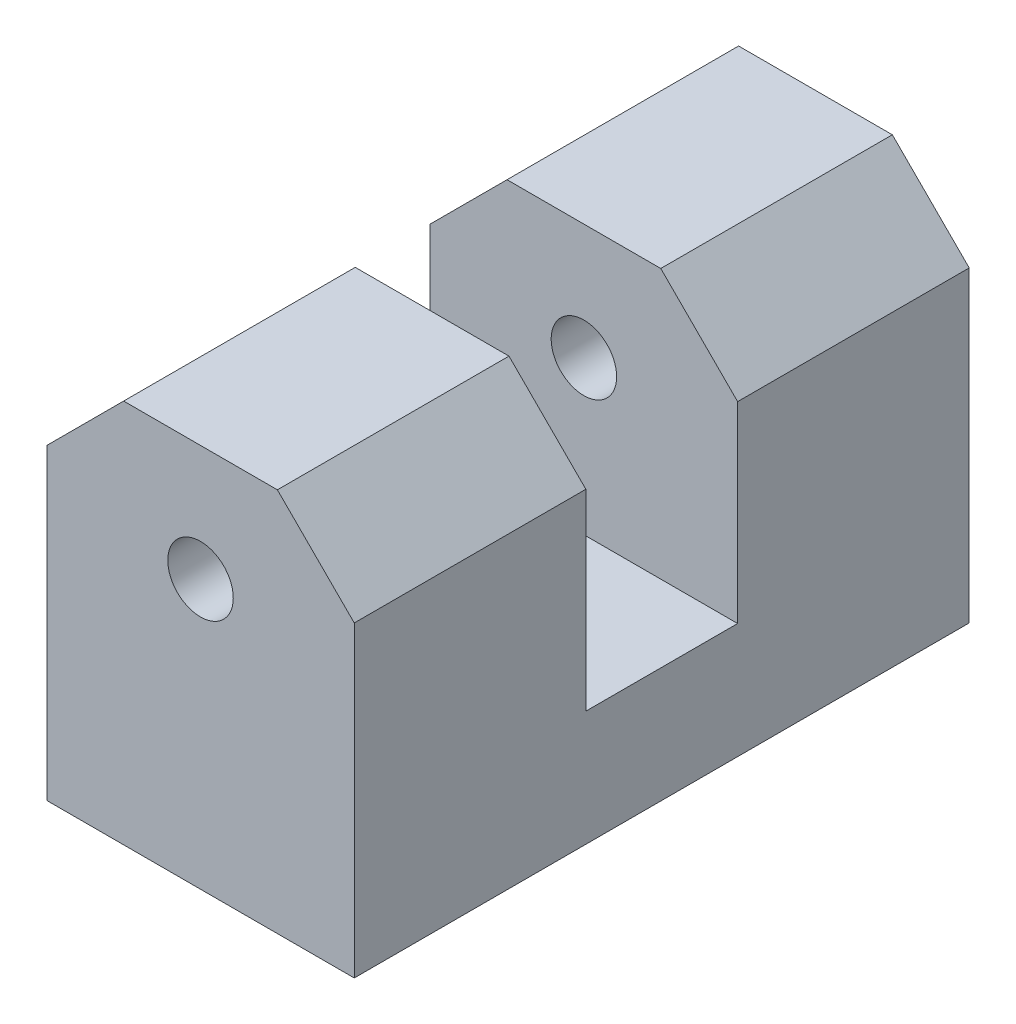
from build123d import *

# Parameters (mm, degrees)
SKETCH_1_W          = 8
SKETCH_1_H          = 16
EXTRUDE_1_DEPTH     = 10
SKETCH_2_R          = 0.852
CUT_EXTRUDE_1_DEPTH = 20.287301522
SKETCH_3_W          = 11.235534132
SKETCH_3_H          = 3.949082568
CUT_EXTRUDE_2_DEPTH = 7
CHAMFER_1_SIZE      = 2


with BuildPart() as part:
    # Эскиз1 → Вытянуть1 (new body)
    with BuildSketch(Plane(origin=(0, 0, 0), x_dir=(1, 0, 0), z_dir=(0, 1, 0))):
        Rectangle(SKETCH_1_W, SKETCH_1_H)
    extrude(amount=EXTRUDE_1_DEPTH)

    # Эскиз2 → Вырез-Вытянуть1 (cut, through all)
    with BuildSketch(Plane.XY.offset(8)):
        with Locations((0, 6.986387237)):
            Circle(SKETCH_2_R)
    extrude(amount=-CUT_EXTRUDE_1_DEPTH, mode=Mode.SUBTRACT)

    # Эскиз3 → Вырез-Вытянуть2 (cut)
    with BuildSketch(Plane(origin=(0, 10, 0), x_dir=(1, 0, 0), z_dir=(0, 1, 0))):
        Rectangle(SKETCH_3_W, SKETCH_3_H)
    extrude(amount=-CUT_EXTRUDE_2_DEPTH, mode=Mode.SUBTRACT)

    # Фаска1
    chamfer_1_edges = [part.edges().sort_by_distance(p)[0] for p in [
        (-4, 10, -4.987270642),
        (4, 10, -4.987270642),
        (-4, 10, 4.987270642),
        (4, 10, 4.987270642),
    ]]
    chamfer(chamfer_1_edges, length=CHAMFER_1_SIZE)


solid = part.part
